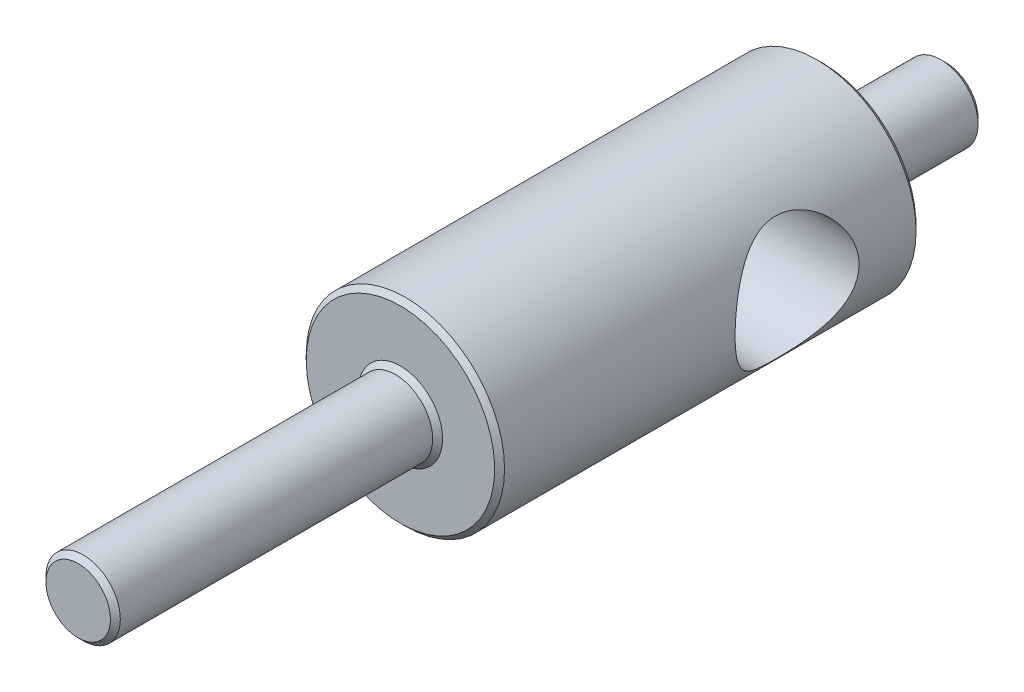
from build123d import *

# Parameters (mm, degrees)
SKETCH1_R               = 1.5
BOSS_EXTRUDE1_DEPTH     = 13
SKETCH2_R               = 4
BOSS_EXTRUDE2_DEPTH     = 17
SKETCH3_R               = 1.5
BOSS_EXTRUDE3_DEPTH     = 5
CUT_EXTRUDE1_DEPTH      = 36.454195802
CUT_EXTRUDE1_DEPTH_BACK = 36.454195802
SKETCH4_R               = 2.5
CHAMFER1_SIZE           = 0.2


with BuildPart() as part:
    # Sketch1 → Boss-Extrude1 (new body)
    with BuildSketch(Plane.XY):
        Circle(SKETCH1_R)
    extrude(amount=-BOSS_EXTRUDE1_DEPTH)

    # Sketch2 → Boss-Extrude2 (add)
    with BuildSketch(Plane(origin=(0, 0, -13), x_dir=(-1, 0, 0), z_dir=(0, 0, -1))):
        Circle(SKETCH2_R)
    extrude(amount=BOSS_EXTRUDE2_DEPTH)

    # Sketch3 → Boss-Extrude3 (add)
    with BuildSketch(Plane(origin=(0, 0, -30), x_dir=(-1, 0, 0), z_dir=(0, 0, -1))):
        with Locations(Location((0, 0, 0), (0, 0, 180))):
            Circle(SKETCH3_R)
    extrude(amount=BOSS_EXTRUDE3_DEPTH)

    # Sketch4 → Cut-Extrude1 (cut, two sides: drawn at the far end of the back side and taken through both)
    with BuildSketch(Plane(origin=(0, 0, 0), x_dir=(0, 0, -1), z_dir=(1, 0, 0)).offset(-CUT_EXTRUDE1_DEPTH_BACK)):
        with Locations((25, 0)):
            Circle(SKETCH4_R)
    extrude(amount=CUT_EXTRUDE1_DEPTH + CUT_EXTRUDE1_DEPTH_BACK, mode=Mode.SUBTRACT)

    # Chamfer1
    chamfer1_edges = [part.edges().sort_by_distance(p)[0] for p in [
        (-1.5, 0, -30),
        (-1.5, 0, -35),
        (-1.5, 0, 0),
        (-1.5, 0, -13),
        (4, 0, -13),
        (4, 0, -30),
    ]]
    chamfer(chamfer1_edges, length=CHAMFER1_SIZE)


solid = part.part
